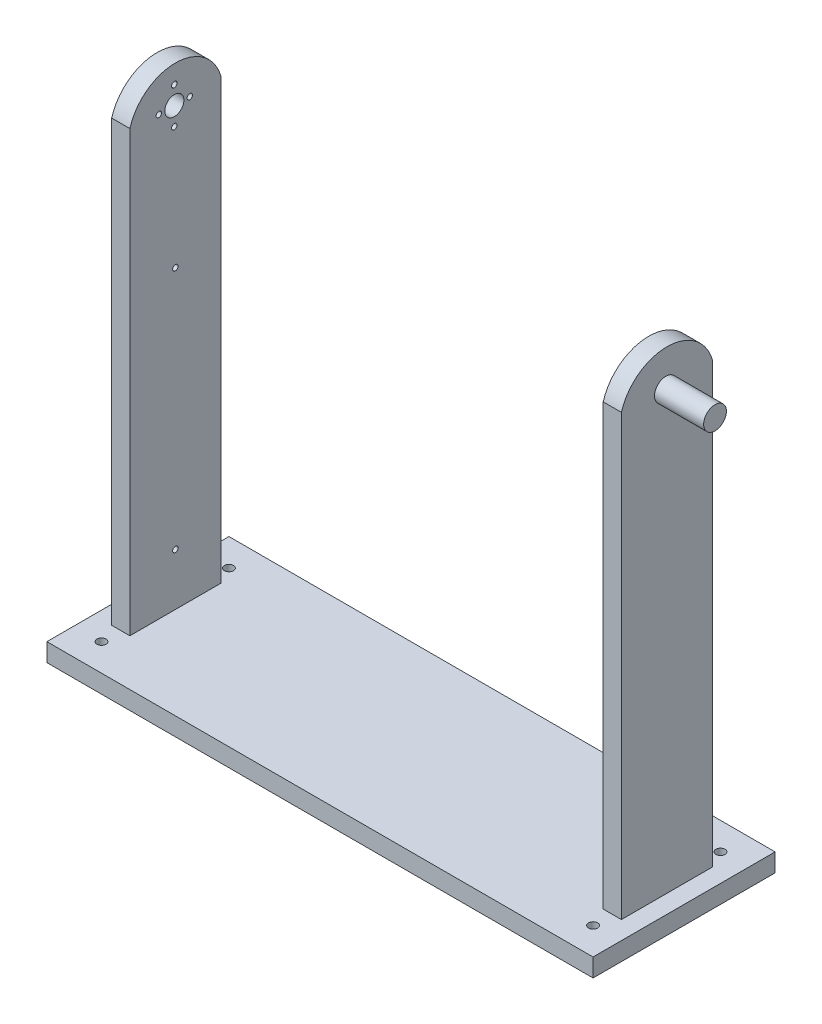
from build123d import *

# Parameters (mm, degrees)
SKETCH1_W               = 300
SKETCH1_H               = 100
SKETCH1_R               = 2.5
BOSS_EXTRUDE1_DEPTH     = 10
SKETCH2_W               = 10
SKETCH2_H               = 50
BOSS_EXTRUDE2_DEPTH     = 260
SKETCH3_R               = 5.25
CUT_EXTRUDE1_DEPTH      = 20
CUT_EXTRUDE2_DEPTH      = 411.984872046
CUT_EXTRUDE2_DEPTH_BACK = 411.984872046
SKETCH5_R               = 1.5
CUT_EXTRUDE3_DEPTH      = 10
SKETCH7_R               = 1.5
CUT_EXTRUDE6_DEPTH      = 10
SKETCH8_R               = 1.5
CUT_EXTRUDE7_DEPTH      = 10
SKETCH12_R              = 6.25
BOSS_EXTRUDE4_DEPTH     = 27
CUT_EXTRUDE10_START     = -34
SKETCH13_R              = 5.25
CUT_EXTRUDE10_DEPTH     = 34


with BuildPart() as part:
    # Sketch1 → Boss-Extrude1 (new body)
    with BuildSketch(Plane(origin=(0, 0, 0), x_dir=(1, 0, 0), z_dir=(0, 1, 0))):
        with Locations((37.664745703, -59.126371929)):
            Rectangle(SKETCH1_W, SKETCH1_H)
        with Locations(Location((-97.335254297, -24.126371929, 0), (0, 0, 270))):
            Circle(SKETCH1_R, mode=Mode.SUBTRACT)
        with Locations(Location((-97.335254297, -94.126371929, 0), (0, 0, 90))):
            Circle(SKETCH1_R, mode=Mode.SUBTRACT)
        with Locations(Location((172.664745703, -24.126371929, 0), (0, 0, 90))):
            Circle(SKETCH1_R, mode=Mode.SUBTRACT)
        with Locations(Location((172.664745703, -94.126371929, 0), (0, 0, 270))):
            Circle(SKETCH1_R, mode=Mode.SUBTRACT)
    extrude(amount=BOSS_EXTRUDE1_DEPTH)

    # Sketch2 → Boss-Extrude2 (add)
    with BuildSketch(Plane(origin=(0, 10, 0), x_dir=(1, 0, 0), z_dir=(0, 1, 0))):
        with Locations((172.664745703, -58.546819536)):
            Rectangle(SKETCH2_W, SKETCH2_H)
        with Locations((-97.335254297, -58.546819536)):
            Rectangle(SKETCH2_W, SKETCH2_H)
    extrude(amount=BOSS_EXTRUDE2_DEPTH)

    # Sketch3 → Cut-Extrude1 (cut)
    with BuildSketch(Plane.ZY.offset(82.335254297)):
        with Locations((59.126371929, 250)):
            Circle(SKETCH3_R)
    extrude(amount=CUT_EXTRUDE1_DEPTH, mode=Mode.SUBTRACT)

    # Sketch4 → Cut-Extrude2 (cut, two sides: drawn at the far end of the back side and taken through both)
    with BuildSketch(Plane.ZY.offset(102.335254297).offset(-CUT_EXTRUDE2_DEPTH_BACK)):
        with BuildLine():
            Line((83.546819536, 270), (58.546819536, 270))
            ThreePointArc((58.546819536, 270), (74.165001003, 264.798991748), (83.546819536, 251.27273727))
            Line((83.546819536, 251.27273727), (83.546819536, 270))
        make_face()
        with BuildLine():
            Line((33.546819536, 270), (33.546819536, 251.27273727))
            ThreePointArc((33.546819536, 251.27273727), (42.928638069, 264.798991748), (58.546819536, 270))
            Line((58.546819536, 270), (33.546819536, 270))
        make_face()
    extrude(amount=CUT_EXTRUDE2_DEPTH + CUT_EXTRUDE2_DEPTH_BACK, mode=Mode.SUBTRACT)

    # Sketch5 → Cut-Extrude3 (cut)
    with BuildSketch(Plane.ZY.offset(102.335254297)):
        with Locations((58.546819536, 172.564056087)):
            Circle(SKETCH5_R)
        with Locations((58.546819536, 38.564056087)):
            Circle(SKETCH5_R)
    extrude(amount=-CUT_EXTRUDE3_DEPTH, mode=Mode.SUBTRACT)

    # Sketch7 → Cut-Extrude6 (cut)
    with BuildSketch(Plane.ZY.offset(102.335254297)):
        with Locations((59.126371929, 260)):
            Circle(SKETCH7_R)
        with Locations((59.126371929, 240)):
            Circle(SKETCH7_R)
    extrude(amount=-CUT_EXTRUDE6_DEPTH, mode=Mode.SUBTRACT)

    # Sketch8 → Cut-Extrude7 (cut)
    with BuildSketch(Plane.ZY.offset(102.335254297)):
        with Locations((50.626371929, 250)):
            Circle(SKETCH8_R)
        with Locations((67.626371929, 250)):
            Circle(SKETCH8_R)
    extrude(amount=-CUT_EXTRUDE7_DEPTH, mode=Mode.SUBTRACT)

    # Sketch12 → Boss-Extrude4 (add)
    with BuildSketch(Plane(origin=(177.664745703, 0, 0), x_dir=(0, 0, -1), z_dir=(1, 0, 0))):
        with Locations(Location((-59.126371929, 250, 0), (0, 0, 180))):
            Circle(SKETCH12_R)
    extrude(amount=BOSS_EXTRUDE4_DEPTH)

    # Sketch13 → Cut-Extrude10 (cut)
    with BuildSketch(Plane.ZY.offset(-167.664745703).offset(CUT_EXTRUDE10_START)):
        with Locations((59.126371929, 250)):
            Circle(SKETCH13_R)
    extrude(amount=CUT_EXTRUDE10_DEPTH, mode=Mode.SUBTRACT)


solid = part.part
